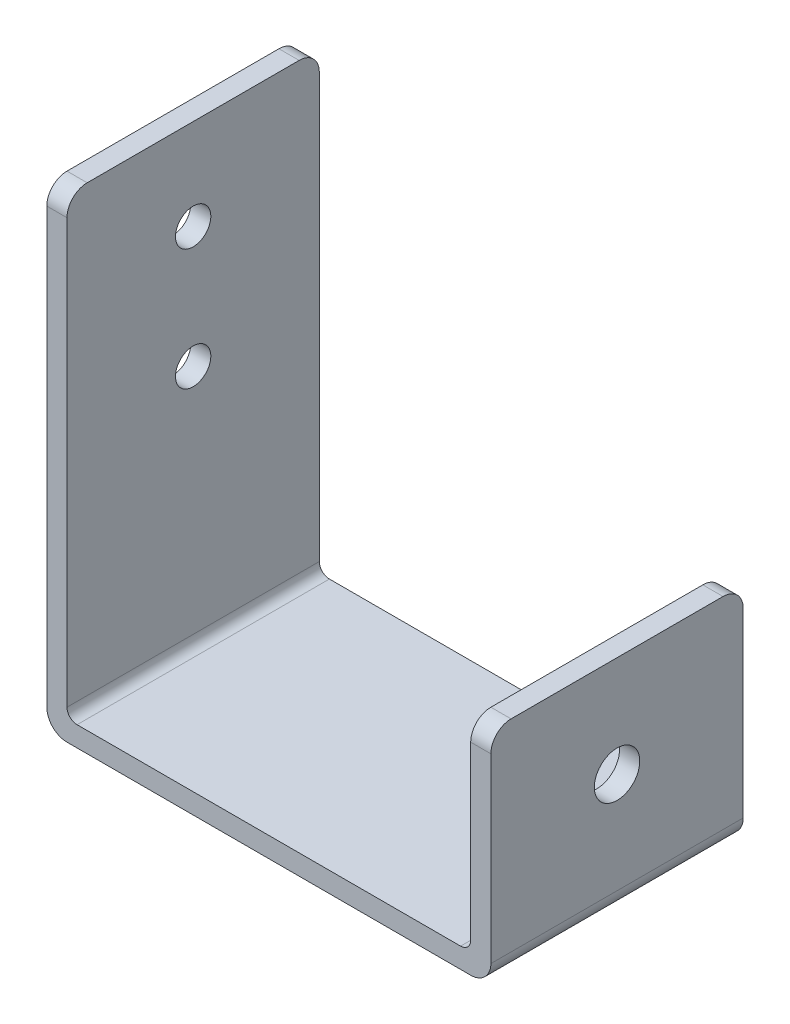
from build123d import *

# Parameters (mm, degrees)
EXTRU_MINCE1_DEPTH      = 25
CONG_1_R                = 1
CONG_2_R                = 1
CONG_3_R                = 2
CONG_4_R                = 2
ESQUISSE2_R             = 1.75
ENL_V_MAT_EXTRU_1_DEPTH = 2
ESQUISSE3_R             = 2.25
ENL_V_MAT_EXTRU_2_DEPTH = 2
CONG_12_R               = 2
CONG_13_R               = 2
CONG_15_R               = 2
CONG_16_R               = 2


with BuildPart() as part:
    # Esquisse1 → Extru.-Mince1 (new body)
    with BuildSketch(Plane.XY):
        Polygon((0, 45), (0, 0), (40, 0), (40, 20), (42, 20), (42, -2), (-2, -2), (-2, 45), align=None)
    extrude(amount=EXTRU_MINCE1_DEPTH)

    # Congé1
    cong_1_edges = [part.edges().sort_by_distance(p)[0] for p in [
        (0, 0, 12.5),
    ]]
    fillet(cong_1_edges, radius=CONG_1_R)

    # Congé2
    cong_2_edges = [part.edges().sort_by_distance(p)[0] for p in [
        (40, 0, 12.5),
    ]]
    fillet(cong_2_edges, radius=CONG_2_R)

    # Congé3
    cong_3_edges = [part.edges().sort_by_distance(p)[0] for p in [
        (42, -2, 12.5),
    ]]
    fillet(cong_3_edges, radius=CONG_3_R)

    # Congé4
    cong_4_edges = [part.edges().sort_by_distance(p)[0] for p in [
        (-2, -2, 12.5),
    ]]
    fillet(cong_4_edges, radius=CONG_4_R)

    # Esquisse2 → Enlèv. mat.-Extru.1 (cut)
    with BuildSketch(Plane.ZY.offset(2)):
        with Locations((12.5, 36)):
            Circle(ESQUISSE2_R)
        with Locations((12.5, 24)):
            Circle(ESQUISSE2_R)
    extrude(amount=-ENL_V_MAT_EXTRU_1_DEPTH, mode=Mode.SUBTRACT)

    # Esquisse3 → Enlèv. mat.-Extru.2 (cut)
    with BuildSketch(Plane(origin=(42, 0, 0), x_dir=(0, 0, -1), z_dir=(1, 0, 0))):
        with Locations((-12.5, 10)):
            Circle(ESQUISSE3_R)
    extrude(amount=-ENL_V_MAT_EXTRU_2_DEPTH, mode=Mode.SUBTRACT)

    # Congé12
    cong_12_edges = [part.edges().sort_by_distance(p)[0] for p in [
        (41, 20, 0),
    ]]
    fillet(cong_12_edges, radius=CONG_12_R)

    # Congé13
    cong_13_edges = [part.edges().sort_by_distance(p)[0] for p in [
        (41, 20, 25),
    ]]
    fillet(cong_13_edges, radius=CONG_13_R)

    # Congé15
    cong_15_edges = [part.edges().sort_by_distance(p)[0] for p in [
        (-1, 45, 0),
    ]]
    fillet(cong_15_edges, radius=CONG_15_R)

    # Congé16
    cong_16_edges = [part.edges().sort_by_distance(p)[0] for p in [
        (-1, 45, 25),
    ]]
    fillet(cong_16_edges, radius=CONG_16_R)


solid = part.part
